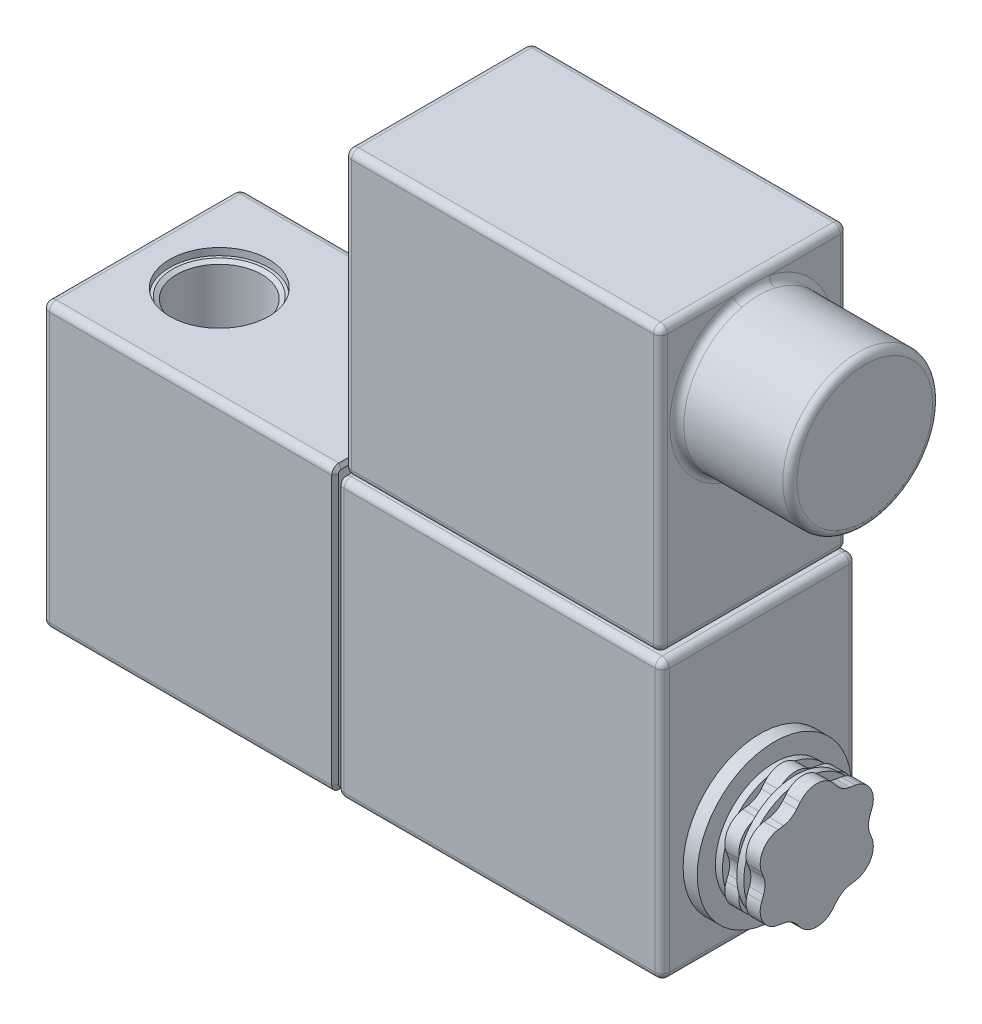
from build123d import *
from OCP.BRepFilletAPI import BRepFilletAPI_MakeChamfer

# Parameters (mm, degrees)
SKETCH_1_W          = 20.651248271
SKETCH_1_H          = 14
EXTRUDE_1_DEPTH     = 20
SKETCH_2_R          = 5.854981088
EXTRUDE_3_DEPTH     = 0.2
SKETCH_3_W          = 13.724579626
SKETCH_3_H          = 19.611333187
EXTRUDE_4_DEPTH     = 23
SKETCH_4_R          = 5.076570085
EXTRUDE_5_DEPTH     = 0.2
SKETCH_5_W          = 22.349188005
SKETCH_5_H          = 13.223937402
EXTRUDE_6_DEPTH     = 20
FILLET_1_R          = 0.5
FILLET_2_R          = 0.5
FILLET_4_R          = 0.5
CHAMFER_3_SIZE      = 0.3
CHAMFER_3_SIZE2     = 0.173205081
FILLET_5_R          = 0.5
SKETCH_6_R          = 5.453065836
EXTRUDE_7_DEPTH     = 1
SKETCH_7_R          = 4.169540838
EXTRUDE_8_DEPTH     = 0.5
EXTRUDE_9_DEPTH     = 1
SKETCH_9_R          = 4.16265071
EXTRUDE_10_DEPTH    = 0.5
EXTRUDE_12_DEPTH    = 1
SKETCH_12_R         = 5.3
EXTRUDE_13_DEPTH    = 8
FILLET_6_R          = 0.5
SKETCH_24_R         = 3.5
CUT_EXTRUDE_5_DEPTH = 0.5
CUT_EXTRUDE_START   = -0.5
SKETCH_20_R         = 3.5
CUT_EXTRUDE_6_DEPTH = 0.5
SKETCH_26_R         = 3
CUT_EXTRUDE_7_DEPTH = 7
CUT_EXTRUDE_START_2 = -7
SKETCH_25_R         = 3
CUT_EXTRUDE_9_DEPTH = 7
CHAMFER_6_SIZE      = 0.3
CHAMFER_6_SIZE2     = 0.173205081
CHAMFER_7_SIZE      = 0.3
CHAMFER_7_SIZE2     = 0.173205081
SCALE_1_SCALE       = 1.703703703


with BuildPart() as part:
    # 草图1 → 凸台-拉伸1 (new body)
    with BuildSketch(Plane(origin=(0, 0, 0), x_dir=(1, 0, 0), z_dir=(0, 1, 0))):
        with Locations((10.325624136, 7)):
            Rectangle(SKETCH_1_W, SKETCH_1_H)
    extrude(amount=EXTRUDE_1_DEPTH)

    # 草图2 → 凸台-拉伸3 (add)
    with BuildSketch(Plane(origin=(20.651248271, 0, 0), x_dir=(0, 0, -1), z_dir=(1, 0, 0))):
        with Locations((6.862032228, 7.827875607)):
            Circle(SKETCH_2_R)
    extrude(amount=EXTRUDE_3_DEPTH)

    # 草图3 → 凸台-拉伸4 (add)
    with BuildSketch(Plane(origin=(20.851248271, 0, 0), x_dir=(0, 0, -1), z_dir=(1, 0, 0))):
        with Locations((6.862289813, 9.805666593)):
            Rectangle(SKETCH_3_W, SKETCH_3_H)
    extrude(amount=EXTRUDE_4_DEPTH)

    # 草图4 → 凸台-拉伸5 (add)
    with BuildSketch(Plane(origin=(0, 19.611333187, 0), x_dir=(1, 0, 0), z_dir=(0, 1, 0))):
        with Locations(Location((31.541479315, 6.463403643, 0), (0, 0, 270))):
            Circle(SKETCH_4_R)
    extrude(amount=EXTRUDE_5_DEPTH)

    # 草图5 → 凸台-拉伸6 (add)
    with BuildSketch(Plane(origin=(0, 19.811333187, 0), x_dir=(1, 0, 0), z_dir=(0, 1, 0))):
        with Locations((32.341315112, 6.824860963)):
            Rectangle(SKETCH_5_W, SKETCH_5_H)
    extrude(amount=EXTRUDE_6_DEPTH)

    # 圆角1
    fillet_1_edges = [part.edges().sort_by_distance(p)[0] for p in [
        (10.325624135, 20, -14),
        (10.325624135, 20, 0),
        (10.325624135, 0, -14),
        (10.325624135, 0, 0),
    ]]
    fillet(fillet_1_edges, radius=FILLET_1_R)

    # 圆角2
    fillet_2_edges = [part.edges().sort_by_distance(p)[0] for p in [
        (0, 10, -14),
        (0, 0, -7),
        (0, 10, 0),
        (0, 20, -7),
        (0, 19.853553391, -0.146446609),
        (0, 0.146446609, -0.146446609),
        (0, 19.853553391, -13.853553391),
        (0, 0.146446609, -13.853553391),
    ]]
    fillet(fillet_2_edges, radius=FILLET_2_R)

    # 圆角4
    fillet_4_edges = [part.edges().sort_by_distance(p)[0] for p in [
        (20.851248271, 9.805666594, 0),
        (32.351248271, 19.611333187, 0),
        (20.851248271, 0, -6.862289813),
        (32.351248271, 0, 0),
        (20.851248271, 9.805666594, -13.724579626),
        (32.351248271, 0, -13.724579626),
        (20.851248271, 19.611333187, -6.862289813),
        (32.351248271, 19.611333187, -13.724579626),
        (43.851248271, 9.805666594, 0),
        (43.851248271, 0, -6.862289813),
        (43.851248271, 9.805666594, -13.724579626),
        (43.851248271, 19.611333187, -6.862289813),
    ]]
    fillet(fillet_4_edges, radius=FILLET_4_R)

    # 倒角3
    chamfer_3_edges = [part.edges().sort_by_distance(p)[0] for p in [
        (20.651248271, 10, -14),
        (20.651248271, 0, -7),
        (20.651248271, 20, -7),
        (20.651248271, 10, 0),
        (20.651248271, 19.853553391, -0.146446609),
        (20.651248271, 0.146446609, -0.146446609),
        (20.651248271, 19.853553391, -13.853553391),
        (20.651248271, 0.146446609, -13.853553391),
    ]]
    chamfer_3_side = [part.faces().sort_by_distance(p)[0] for p in [
        (20.651248271, 10, -13.755868888),
    ]]
    chamfer(chamfer_3_edges, length=CHAMFER_3_SIZE, length2=CHAMFER_3_SIZE2, reference=chamfer_3_side[0])

    # 圆角5
    fillet_5_edges = [part.edges().sort_by_distance(p)[0] for p in [
        (43.515909114, 19.811333187, -6.824860963),
        (43.515909114, 29.811333187, -0.212892262),
        (32.341315112, 19.811333187, -13.436829664),
        (43.515909114, 29.811333187, -13.436829664),
        (21.166721109, 19.811333187, -6.824860963),
        (21.166721109, 29.811333187, -13.436829664),
        (32.341315112, 19.811333187, -0.212892262),
        (21.166721109, 29.811333187, -0.212892262),
        (43.515909114, 39.811333187, -6.824860963),
        (32.341315112, 39.811333187, -13.436829664),
        (21.166721109, 39.811333187, -6.824860963),
        (32.341315112, 39.811333187, -0.212892262),
    ]]
    fillet(fillet_5_edges, radius=FILLET_5_R)

    # 草图6 → 凸台-拉伸7 (add)
    with BuildSketch(Plane(origin=(43.851248271, 0, 0), x_dir=(0, 0, -1), z_dir=(1, 0, 0))):
        with Locations(Location((6.932896129, 6.444570849, 0), (0, 0, 180))):
            Circle(SKETCH_6_R)
    extrude(amount=EXTRUDE_7_DEPTH)

    # 草图7 → 凸台-拉伸8 (add)
    with BuildSketch(Plane(origin=(44.851248271, 0, 0), x_dir=(0, 0, -1), z_dir=(1, 0, 0))):
        with Locations((6.932896129, 6.444570849)):
            Circle(SKETCH_7_R)
    extrude(amount=EXTRUDE_8_DEPTH)

    # 草图8 → 凸台-拉伸9 (add)
    with BuildSketch(Plane(origin=(45.351248271, 0, 0), x_dir=(0, 0, -1), z_dir=(1, 0, 0))):
        with BuildLine():
            Line((8.098804904, 10.276711736), (8.347186195, 9.969860218))
            ThreePointArc((8.347186195, 9.969860218), (8.763094969, 9.614568228), (9.278741246, 9.432026659))
            Line((9.278741246, 9.432026659), (9.668673101, 9.370347909))
            ThreePointArc((9.668673101, 9.370347909), (10.733357483, 8.638768235), (10.834581875, 7.350934675))
            Line((10.834581875, 7.350934675), (10.693031312, 6.982404408))
            ThreePointArc((10.693031312, 6.982404408), (10.59329381, 6.444570849), (10.693031312, 5.90673729))
            Line((10.693031312, 5.90673729), (10.834581875, 5.538207023))
            ThreePointArc((10.834581875, 5.538207023), (10.733357483, 4.250373464), (9.668673101, 3.518793789))
            Line((9.668673101, 3.518793789), (9.278741246, 3.457115039))
            ThreePointArc((9.278741246, 3.457115039), (8.763094969, 3.27457347), (8.347186195, 2.91928148))
            Line((8.347186195, 2.91928148), (8.098804904, 2.612429963))
            ThreePointArc((8.098804904, 2.612429963), (6.932896129, 2.056176078), (5.766987355, 2.612429963))
            Line((5.766987355, 2.612429963), (5.518606063, 2.91928148))
            ThreePointArc((5.518606063, 2.91928148), (5.102697289, 3.27457347), (4.587051013, 3.457115039))
            Line((4.587051013, 3.457115039), (4.197119158, 3.518793789))
            ThreePointArc((4.197119158, 3.518793789), (3.132434776, 4.250373464), (3.031210384, 5.538207023))
            Line((3.031210384, 5.538207023), (3.172760947, 5.90673729))
            ThreePointArc((3.172760947, 5.90673729), (3.272498449, 6.444570849), (3.172760947, 6.982404408))
            Line((3.172760947, 6.982404408), (3.031210384, 7.350934675))
            ThreePointArc((3.031210384, 7.350934675), (3.132434776, 8.638768235), (4.197119158, 9.370347909))
            Line((4.197119158, 9.370347909), (4.587051013, 9.432026659))
            ThreePointArc((4.587051013, 9.432026659), (5.102697289, 9.614568228), (5.518606063, 9.969860218))
            Line((5.518606063, 9.969860218), (5.766987355, 10.276711736))
            ThreePointArc((5.766987355, 10.276711736), (6.932896129, 10.83296562), (8.098804904, 10.276711736))
        make_face()
    extrude(amount=EXTRUDE_9_DEPTH)

    # 草图9 → 凸台-拉伸10 (add)
    with BuildSketch(Plane(origin=(46.351248271, 0, 0), x_dir=(0, 0, -1), z_dir=(1, 0, 0))):
        with Locations(Location((6.932896129, 6.444570849, 0), (0, 0, 163.105026242))):
            Circle(SKETCH_9_R)
    extrude(amount=EXTRUDE_10_DEPTH)

    # 草图11 → 凸台-拉伸12 (add)
    with BuildSketch(Plane(origin=(46.851248271, 0, 0), x_dir=(0, 0, -1), z_dir=(1, 0, 0))):
        with BuildLine():
            Line((8.098804904, 10.276711736), (8.347186195, 9.969860218))
            ThreePointArc((8.347186195, 9.969860218), (8.763094969, 9.614568228), (9.278741246, 9.432026659))
            Line((9.278741246, 9.432026659), (9.668673101, 9.370347909))
            ThreePointArc((9.668673101, 9.370347909), (10.733357483, 8.638768235), (10.834581875, 7.350934675))
            Line((10.834581875, 7.350934675), (10.693031312, 6.982404408))
            ThreePointArc((10.693031312, 6.982404408), (10.59329381, 6.444570849), (10.693031312, 5.90673729))
            Line((10.693031312, 5.90673729), (10.834581875, 5.538207023))
            ThreePointArc((10.834581875, 5.538207023), (10.733357483, 4.250373464), (9.668673101, 3.518793789))
            Line((9.668673101, 3.518793789), (9.278741246, 3.457115039))
            ThreePointArc((9.278741246, 3.457115039), (8.763094969, 3.27457347), (8.347186195, 2.91928148))
            Line((8.347186195, 2.91928148), (8.098804904, 2.612429963))
            ThreePointArc((8.098804904, 2.612429963), (6.932896129, 2.056176078), (5.766987355, 2.612429963))
            Line((5.766987355, 2.612429963), (5.518606063, 2.91928148))
            ThreePointArc((5.518606063, 2.91928148), (5.102697289, 3.27457347), (4.587051013, 3.457115039))
            Line((4.587051013, 3.457115039), (4.197119158, 3.518793789))
            ThreePointArc((4.197119158, 3.518793789), (3.132434776, 4.250373464), (3.031210384, 5.538207023))
            Line((3.031210384, 5.538207023), (3.172760947, 5.90673729))
            ThreePointArc((3.172760947, 5.90673729), (3.272498449, 6.444570849), (3.172760947, 6.982404408))
            Line((3.172760947, 6.982404408), (3.031210384, 7.350934675))
            ThreePointArc((3.031210384, 7.350934675), (3.132434776, 8.638768235), (4.197119158, 9.370347909))
            Line((4.197119158, 9.370347909), (4.587051013, 9.432026659))
            ThreePointArc((4.587051013, 9.432026659), (5.102697289, 9.614568228), (5.518606063, 9.969860218))
            Line((5.518606063, 9.969860218), (5.766987355, 10.276711736))
            ThreePointArc((5.766987355, 10.276711736), (6.932896129, 10.83296562), (8.098804904, 10.276711736))
        make_face()
    extrude(amount=EXTRUDE_12_DEPTH)

    # 草图12 → 凸台-拉伸13 (add)
    with BuildSketch(Plane(origin=(43.515909114, 0, 0), x_dir=(0, 0, -1), z_dir=(1, 0, 0))):
        with Locations(Location((6.66831966, 33.658325061, 0), (0, 0, 180))):
            Circle(SKETCH_12_R)
    extrude(amount=EXTRUDE_13_DEPTH)

    # 圆角6
    fillet_6_edges = [part.edges().sort_by_distance(p)[0] for p in [
        (43.515909114, 33.658325061, -11.96831966),
        (51.515909114, 33.658325061, -11.96831966),
    ]]
    fillet(fillet_6_edges, radius=FILLET_6_R)

    # 草图24 → 切除-拉伸5 (cut)
    with BuildSketch(Plane(origin=(0, 20, 0), x_dir=(1, 0, 0), z_dir=(0, 1, 0))):
        with Locations(Location((5.520457717, 7, 0), (0, 0, 270))):
            Circle(SKETCH_24_R)
    extrude(amount=-CUT_EXTRUDE_5_DEPTH, mode=Mode.SUBTRACT)

    # 草图20 → 切除-拉伸6 (cut)
    with BuildSketch(Plane(origin=(0, 0, 0), x_dir=(-1, 0, 0), z_dir=(0, -1, 0)).offset(CUT_EXTRUDE_START)):
        with Locations(Location((-5.520457717, 7, 0), (0, 0, 270))):
            Circle(SKETCH_20_R)
    extrude(amount=CUT_EXTRUDE_6_DEPTH, mode=Mode.SUBTRACT)

    # 草图26 → 切除-拉伸7 (cut)
    with BuildSketch(Plane(origin=(0, 0.5, 0), x_dir=(-1, 0, 0), z_dir=(0, -1, 0))):
        with Locations(Location((-5.520457717, 7, 0), (0, 0, 90))):
            Circle(SKETCH_26_R)
    extrude(amount=-CUT_EXTRUDE_7_DEPTH, mode=Mode.SUBTRACT)

    # 草图25 → 切除-拉伸9 (cut)
    with BuildSketch(Plane(origin=(0, 19.5, 0), x_dir=(1, 0, 0), z_dir=(0, 1, 0)).offset(CUT_EXTRUDE_START_2)):
        with Locations(Location((5.520457717, 7, 0), (0, 0, 90))):
            Circle(SKETCH_25_R)
    extrude(amount=CUT_EXTRUDE_9_DEPTH, mode=Mode.SUBTRACT)

    # 倒角6
    chamfer_6_edges = [part.edges().sort_by_distance(p)[0] for p in [
        (5.520457717, 19.5, -4),
    ]]
    chamfer_6_side = [part.faces().sort_by_distance(p)[0] for p in [
        (5.520457717, 19.5, -10.401005051),
    ]]
    chamfer(chamfer_6_edges, length=CHAMFER_6_SIZE, length2=CHAMFER_6_SIZE2, reference=chamfer_6_side[0])

    # 倒角7: one chamfer whose edges measure the first distance from different faces: ONE call of the kernel's chamfer builder (chamfer() names one face for all edges)
    chamfer_7_edges_1 = [part.edges().sort_by_distance(p)[0] for p in [
        (5.520457717, 0, -10.5),
    ]]
    chamfer_7_side_1 = [part.faces().sort_by_distance(p)[0] for p in [
        (11.353337925, 0, -7),
    ]]
    chamfer_7_edges_2 = [part.edges().sort_by_distance(p)[0] for p in [
        (5.520457717, 0.5, -4),
    ]]
    chamfer_7_side_2 = [part.faces().sort_by_distance(p)[0] for p in [
        (5.520457717, 0.5, -10.401005051),
    ]]
    chamfer_7 = BRepFilletAPI_MakeChamfer(part.part.solid().wrapped)
    for e in chamfer_7_edges_1:
        chamfer_7.Add(CHAMFER_7_SIZE, CHAMFER_7_SIZE2, e.wrapped, chamfer_7_side_1[0].wrapped)  # the first distance lies on this face
    for e in chamfer_7_edges_2:
        chamfer_7.Add(CHAMFER_7_SIZE, CHAMFER_7_SIZE2, e.wrapped, chamfer_7_side_2[0].wrapped)  # the first distance lies on this face
    add(Compound.cast(chamfer_7.Shape()), mode=Mode.REPLACE)


with BuildPart() as part_1:
    # 缩放比例1: scaled about (26.825590376, 17.148076895, -6.883390628)
    add(part.part.scale(SCALE_1_SCALE).moved(Location((-18.877267281, -12.067165209, 4.843867474))))


solid = part_1.part
